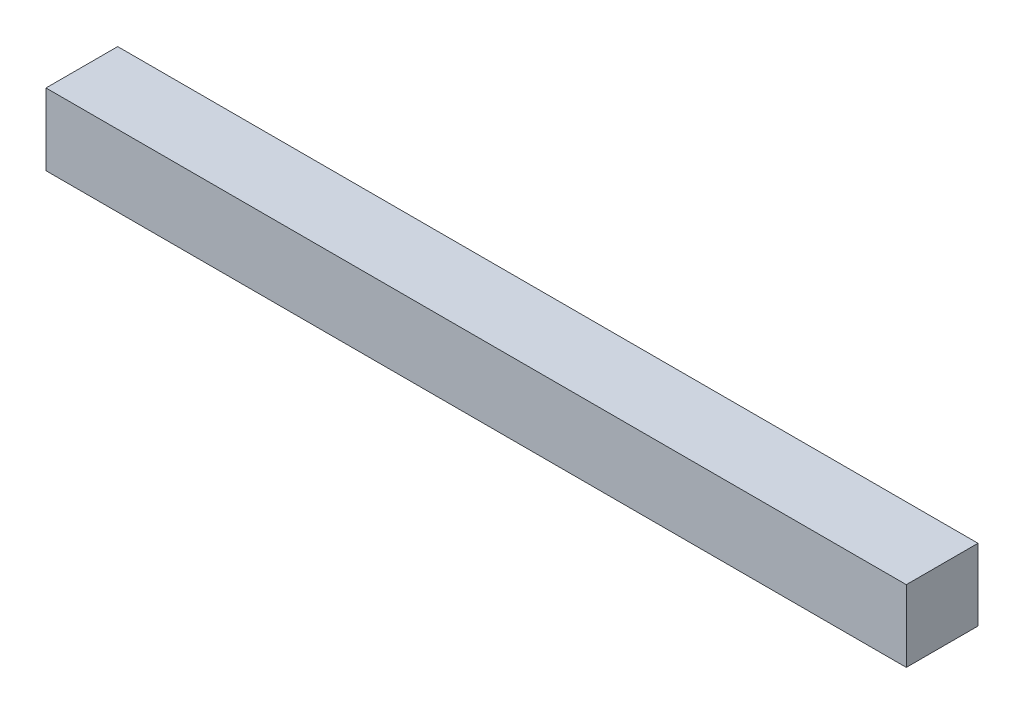
from build123d import *

# Parameters (mm, degrees)
BELT_DRIVE_AXLE_W   = 76.2
BELT_DRIVE_AXLE_H   = 6.35
BOSS_EXTRUDE1_DEPTH = 6.35


with BuildPart() as part:
    # Belt Drive Axle → Boss-Extrude1 (new body)
    with BuildSketch(Plane(origin=(0, 0, 0), x_dir=(1, 0, 0), z_dir=(0, 1, 0))):
        Rectangle(BELT_DRIVE_AXLE_W, BELT_DRIVE_AXLE_H)
    extrude(amount=BOSS_EXTRUDE1_DEPTH)


solid = part.part
